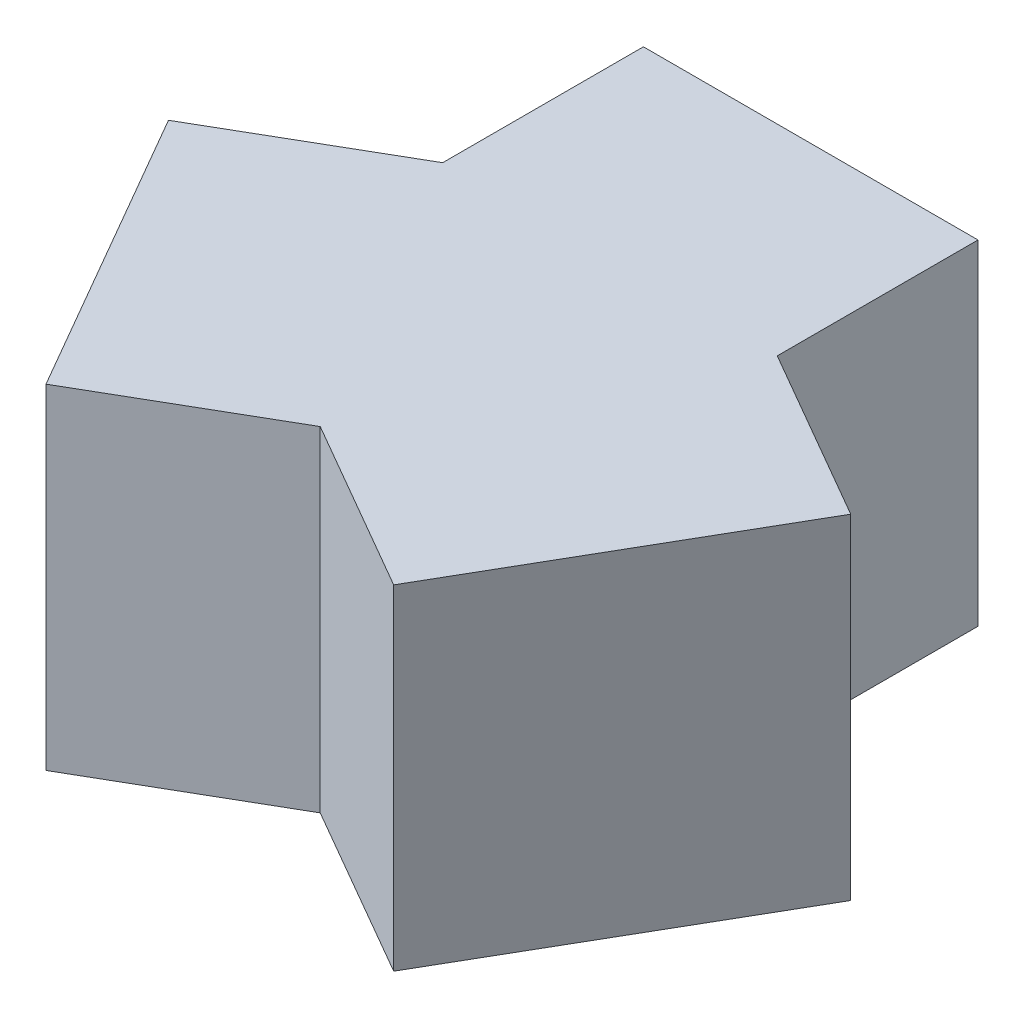
from build123d import *

# Parameters (mm, degrees)
BOSS_EXTRUDE1_DEPTH = 7.5


with BuildPart() as part:
    # Sketch1 → Boss-Extrude1 (new, symmetric)
    with BuildSketch(Plane(origin=(0, 0, 0), x_dir=(1, 0, 0), z_dir=(0, 1, 0))):
        Polygon((15.294228634, 0.5), (7.5, 5), (7.5, 14), (-7.5, 14), (-7.5, 5), (-15.294228634, 0.5), (-7.794228634, -12.490381057), (0, -7.990381057), (7.794228634, -12.490381057), align=None)
    extrude(amount=BOSS_EXTRUDE1_DEPTH, both=True)


solid = part.part
